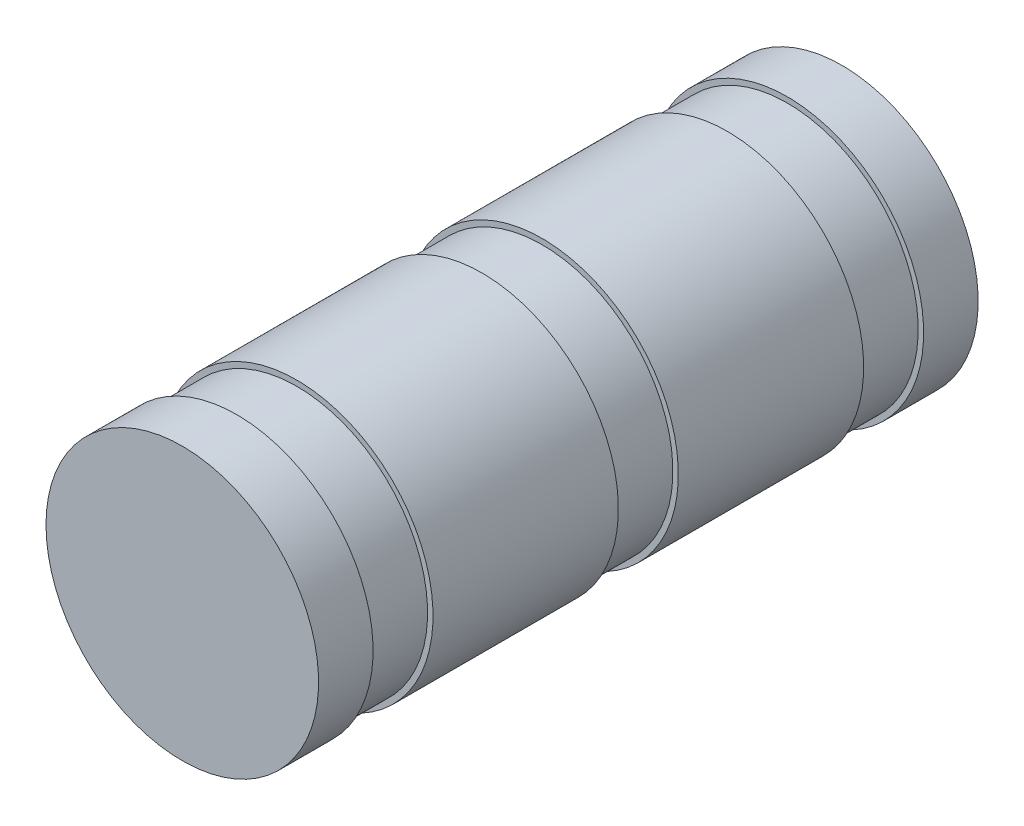
from build123d import *


with BuildPart() as part:
    # Sketch1 → Revolve1 (revolve)
    with BuildSketch(Plane(origin=(0, 0, 0), x_dir=(1, 0, 0), z_dir=(0, 1, 0))):
        Polygon((0, 0), (-2.5, 0), (-2.5, 1), (-2.4, 1), (-2.4, 2.1), (-2.5, 2.1), (-2.5, 5.5), (-2.4, 5.5), (-2.4, 6.6), (-2.5, 6.6), (-2.5, 10), (-2.4, 10), (-2.4, 11.1), (-2.5, 11.1), (-2.5, 12.1), (0, 12.1), align=None)
    revolve(axis=Axis((0, 0, -12.1), (0, 0, 1)))


solid = part.part
